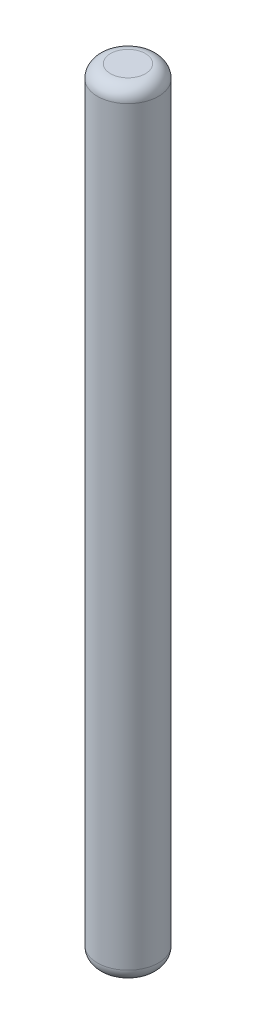
from build123d import *

# Parameters (mm, degrees)
SKETCH_1_R      = 0.35
EXTRUDE_1_DEPTH = 8.9
FILLET_1_R      = 0.15


with BuildPart() as part:
    # 스케치1 → 보스-돌출1 (new body)
    with BuildSketch(Plane(origin=(0, 0, 0), x_dir=(1, 0, 0), z_dir=(0, 1, 0))):
        with Locations(Location((0, 0, 0), (0, 0, 270))):
            Circle(SKETCH_1_R)
    extrude(amount=EXTRUDE_1_DEPTH)

    # 필렛1
    fillet_1_edges = [part.edges().sort_by_distance(p)[0] for p in [
        (0, 0, -0.35),
        (0, 8.9, -0.35),
    ]]
    fillet(fillet_1_edges, radius=FILLET_1_R)


solid = part.part
